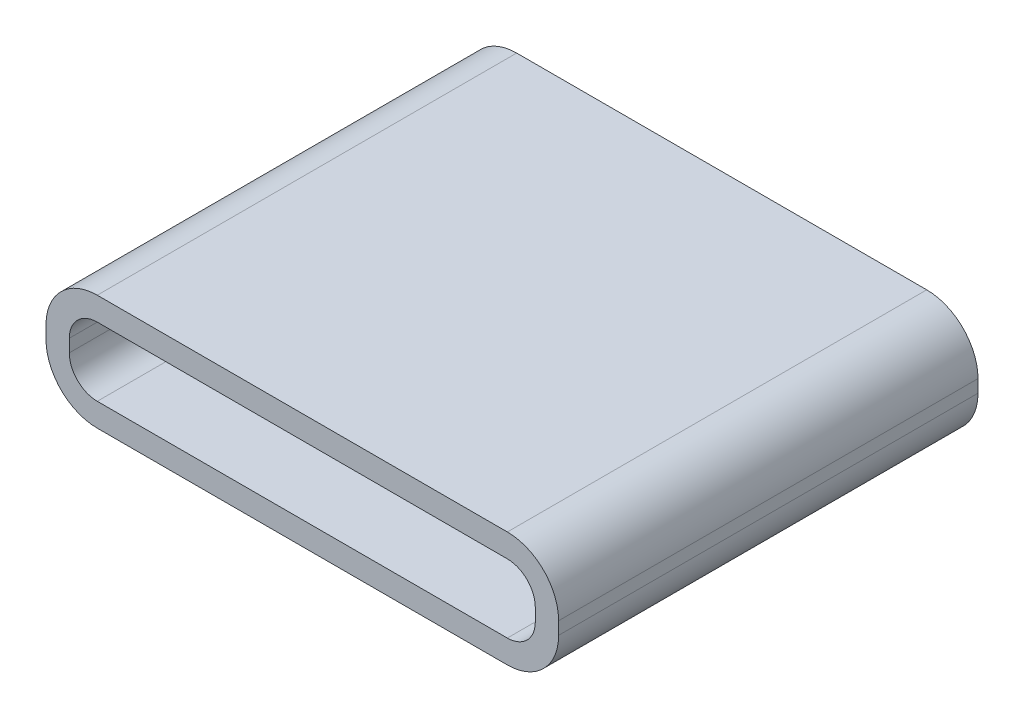
from build123d import *

# Parameters (mm, degrees)
BOSS_EXTRUDE1_DEPTH = 450


with BuildPart() as part:
    # Sketch1 → Boss-Extrude1 (new body)
    with BuildSketch(Plane.XY):
        with BuildLine():
            Line((5, 73.581208516), (445, 73.581208516))
            ThreePointArc((445, 73.581208516), (483.890872965, 57.472081481), (500, 18.581208516))
            Line((500, 18.581208516), (500, 5))
            ThreePointArc((500, 5), (483.890872965, -33.890872965), (445, -50))
            Line((445, -50), (5, -50))
            ThreePointArc((5, -50), (-33.890872965, -33.890872965), (-50, 5))
            Line((-50, 5), (-50, 18.581208516))
            ThreePointArc((-50, 18.581208516), (-33.890872965, 57.472081481), (5, 73.581208516))
        make_face()
        with BuildLine():
            Line((5, 48.581208516), (445, 48.581208516))
            ThreePointArc((445, 48.581208516), (466.213203436, 39.794411951), (475, 18.581208516))
            Line((475, 18.581208516), (475, 5))
            ThreePointArc((475, 5), (466.213203436, -16.213203436), (445, -25))
            Line((445, -25), (5, -25))
            ThreePointArc((5, -25), (-16.213203436, -16.213203436), (-25, 5))
            Line((-25, 5), (-25, 18.581208516))
            ThreePointArc((-25, 18.581208516), (-16.213203436, 39.794411951), (5, 48.581208516))
        make_face(mode=Mode.SUBTRACT)
    extrude(amount=BOSS_EXTRUDE1_DEPTH)


solid = part.part
